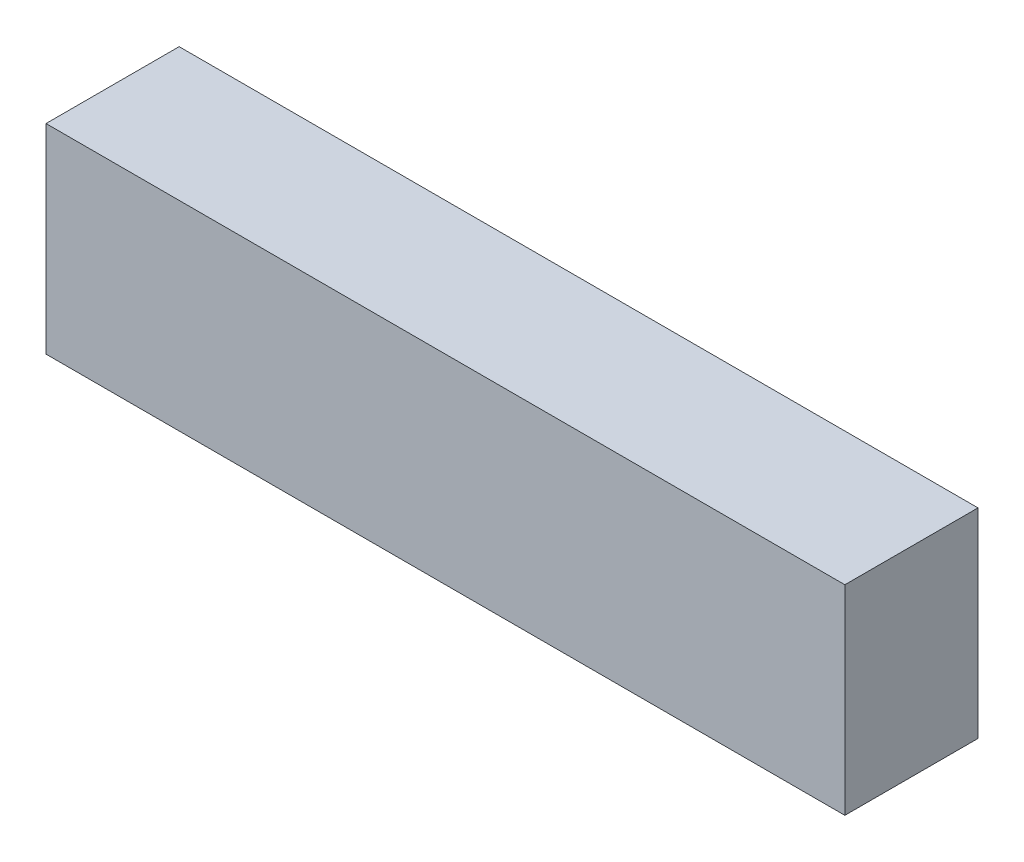
from build123d import *

# Parameters (mm, degrees)
CROQUIS1_W              = 304.8
CROQUIS1_H              = 76.2
SALIENTE_EXTRUIR1_DEPTH = 50.8


with BuildPart() as part:
    # Croquis1 → Saliente-Extruir1 (new body)
    with BuildSketch(Plane.XY):
        Rectangle(CROQUIS1_W, CROQUIS1_H)
    extrude(amount=SALIENTE_EXTRUIR1_DEPTH)


solid = part.part
